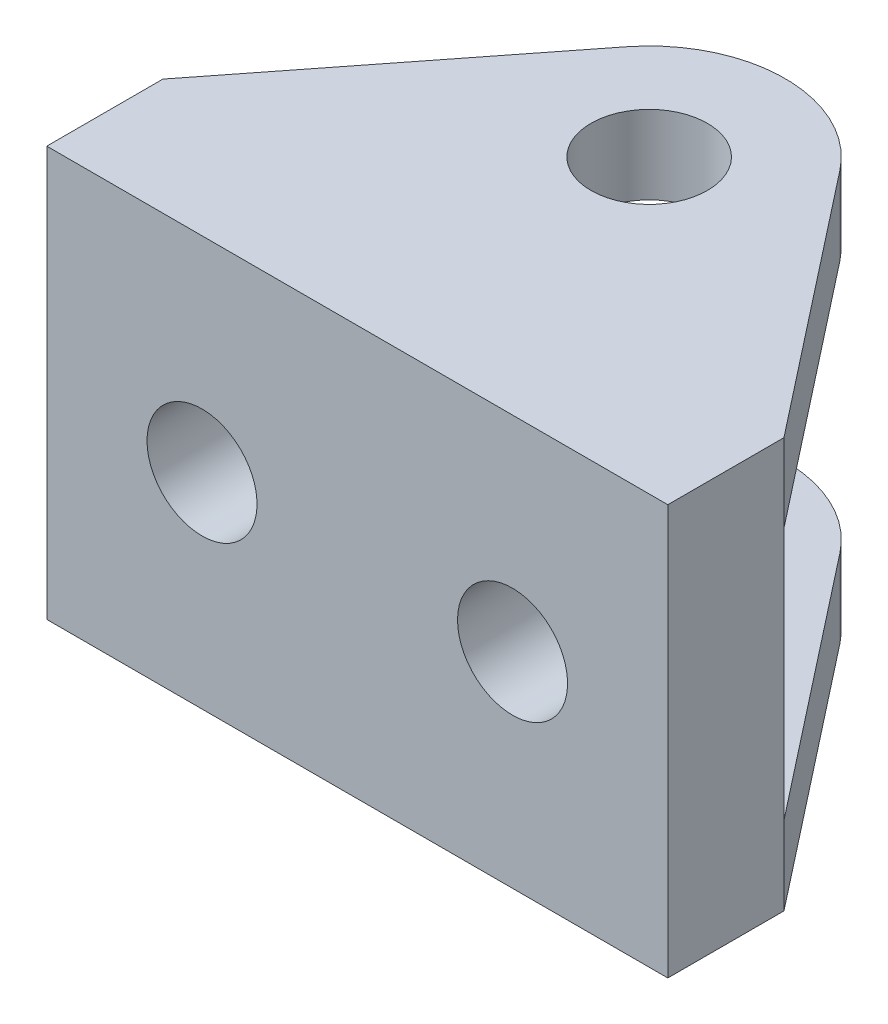
from build123d import *

# Parameters (mm, degrees)
SKETCH1_R           = 4.7625
BOSS_EXTRUDE1_DEPTH = 33.528
CUT_EXTRUDE1_DEPTH  = 71.206566048
SKETCH3_R           = 4.5
CUT_EXTRUDE2_DEPTH  = 9.4996


with BuildPart() as part:
    # Sketch1 → Boss-Extrude1 (new body)
    with BuildSketch(Plane(origin=(0, 0, 0), x_dir=(1, 0, 0), z_dir=(0, 1, 0))):
        with BuildLine():
            Line((0, 0), (50.8, 0))
            Line((50.8, 0), (50.8, 9.4996))
            Line((50.8, 9.4996), (34.143571574, 30.734397216))
            ThreePointArc((34.143571574, 30.734397216), (25.4, 34.9885), (16.656428426, 30.734397216))
            Line((16.656428426, 30.734397216), (0, 9.4996))
            Line((0, 9.4996), (0, 0))
        make_face()
        with Locations(Location((25.4, 23.876, 0), (0, 0, 270))):
            Circle(SKETCH1_R, mode=Mode.SUBTRACT)
    extrude(amount=BOSS_EXTRUDE1_DEPTH)

    # Sketch2 → Cut-Extrude1 (cut, through all)
    with BuildSketch(Plane(origin=(50.8, 0, 0), x_dir=(0, 0, -1), z_dir=(1, 0, 0))):
        Polygon((9.4996, 16.764), (9.4996, 27.1145), (34.9885, 27.1145), (34.9885, 6.4135), (9.4996, 6.4135), align=None)
    extrude(amount=-CUT_EXTRUDE1_DEPTH, mode=Mode.SUBTRACT)

    # Sketch3 → Cut-Extrude2 (cut)
    with BuildSketch(Plane(origin=(0, 0, -9.4996), x_dir=(-1, 0, 0), z_dir=(0, 0, -1))):
        with Locations((-38.1, 16.764)):
            Circle(SKETCH3_R)
        with Locations((-12.7, 16.764)):
            Circle(SKETCH3_R)
    extrude(amount=-CUT_EXTRUDE2_DEPTH, mode=Mode.SUBTRACT)


solid = part.part
